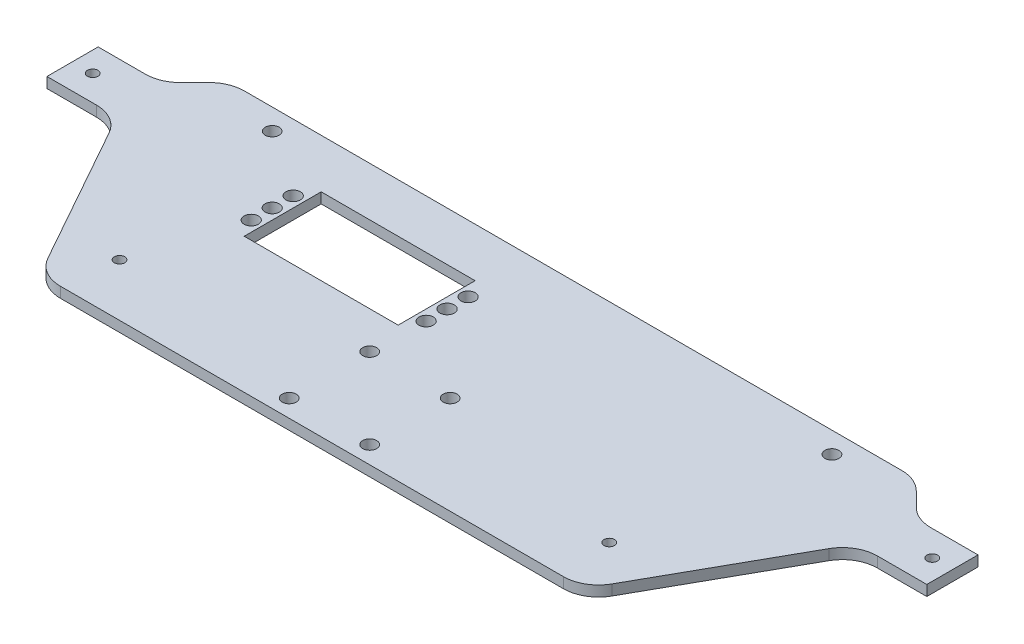
from build123d import *

# Parameters (mm, degrees)
SALIENTE_EXTRUIR1_DEPTH = 3
REDONDEO1_R             = 10
CROQUIS2_R              = 1.5
CROQUIS2_R_2            = 2
CROQUIS2_R_3            = 2.05
CROQUIS2_W              = 42
CROQUIS2_H              = 20
CORTAR_EXTRUIR1_DEPTH   = 135.610141171
CROQUIS3_W              = 4
CROQUIS3_H              = 14.636342218
CORTAR_EXTRUIR2_DEPTH   = 135.610141171
CROQUIS4_W              = 44
CROQUIS4_H              = 22
CORTAR_EXTRUIR3_DEPTH   = 131.820067673
CORTAR_EXTRUIR4_DEPTH   = 131.820067673
REDONDEO2_R             = 20
CORTAR_EXTRUIR5_DEPTH   = 10
REDONDEO3_R             = 10
CROQUIS7_W              = 14.636342218
CROQUIS7_H              = 3
SALIENTE_EXTRUIR2_DEPTH = 2
CROQUIS8_W              = 14.636342218
CROQUIS8_H              = 3
SALIENTE_EXTRUIR3_DEPTH = 2
CROQUIS10_R             = 2
CORTAR_EXTRUIR7_DEPTH   = 133.713564137


with BuildPart() as part:
    # Croquis1 → Saliente-Extruir1 (new body)
    with BuildSketch(Plane(origin=(0, 0, 0), x_dir=(1, 0, 0), z_dir=(0, 1, 0))):
        Polygon((-88.1, 42.318171109), (88.1, 42.318171109), (108.1, 22.318171109), (127.75, 22.318171109), (127.75, 7.681828891), (105.75, 7.681828891), (77.75, -42.318171109), (-77.75, -42.318171109), (-105.75, 7.681828891), (-127.75, 7.681828891), (-127.75, 22.318171109), (-108.1, 22.318171109), align=None)
    extrude(amount=SALIENTE_EXTRUIR1_DEPTH)

    # Redondeo1
    redondeo1_edges = [part.edges().sort_by_distance(p)[0] for p in [
        (-88.1, 1.5, -42.318171109),
        (88.1, 1.5, -42.318171109),
        (108.1, 1.5, -22.318171109),
        (105.75, 1.5, -7.681828891),
        (77.75, 1.5, 42.318171109),
        (-77.75, 1.5, 42.318171109),
        (-105.75, 1.5, -7.681828891),
        (-108.1, 1.5, -22.318171109),
    ]]
    fillet(redondeo1_edges, radius=REDONDEO1_R)

    # Croquis2 → Cortar-Extruir1 (cut, through all)
    with BuildSketch(Plane(origin=(0, 3, 0), x_dir=(1, 0, 0), z_dir=(0, 1, 0))):
        with Locations(Location((70, -27.318171109, 0), (0, 0, 270))):
            Circle(CROQUIS2_R)
        with Locations(Location((-70, -27.318171109, 0), (0, 0, 270))):
            Circle(CROQUIS2_R)
        with Locations(Location((-119.996067812, 15, 0), (0, 0, 270))):
            Circle(CROQUIS2_R)
        with Locations(Location((119.996067812, 15, 0), (0, 0, 270))):
            Circle(CROQUIS2_R)
        with Locations(Location((-11.5, -14.318171109, 0), (0, 0, 270))):
            Circle(CROQUIS2_R_2)
        with Locations(Location((11.5, -14.318171109, 0), (0, 0, 270))):
            Circle(CROQUIS2_R_2)
        with Locations(Location((-11.5, -37.318171109, 0), (0, 0, 270))):
            Circle(CROQUIS2_R_2)
        with Locations(Location((11.5, -37.318171109, 0), (0, 0, 270))):
            Circle(CROQUIS2_R_2)
        with Locations(Location((-61, 7.318171109, 0), (0, 0, 270))):
            Circle(CROQUIS2_R_3)
        with Locations(Location((-11, 7.318171109, 0), (0, 0, 270))):
            Circle(CROQUIS2_R_3)
        with Locations(Location((-61, 13.318171109, 0), (0, 0, 270))):
            Circle(CROQUIS2_R_3)
        with Locations(Location((-61, 1.318171109, 0), (0, 0, 270))):
            Circle(CROQUIS2_R_3)
        with Locations(Location((-11, 13.318171109, 0), (0, 0, 270))):
            Circle(CROQUIS2_R_3)
        with Locations(Location((-11, 1.318171109, 0), (0, 0, 270))):
            Circle(CROQUIS2_R_3)
        with Locations((-36, 7.318171109)):
            Rectangle(CROQUIS2_W, CROQUIS2_H)
    extrude(amount=-CORTAR_EXTRUIR1_DEPTH, mode=Mode.SUBTRACT)

    # Croquis3 → Cortar-Extruir2 (cut, through all)
    with BuildSketch(Plane(origin=(0, 3, 0), x_dir=(1, 0, 0), z_dir=(0, 1, 0))):
        with Locations((-125.75, 15)):
            Rectangle(CROQUIS3_W, CROQUIS3_H)
        with Locations((125.75, 15)):
            Rectangle(CROQUIS3_W, CROQUIS3_H)
    extrude(amount=-CORTAR_EXTRUIR2_DEPTH, mode=Mode.SUBTRACT)

    # Croquis4 → Cortar-Extruir3 (cut, through all)
    with BuildSketch(Plane(origin=(0, 3, 0), x_dir=(1, 0, 0), z_dir=(0, 1, 0))):
        with Locations((-36, 7.318171109)):
            Rectangle(CROQUIS4_W, CROQUIS4_H)
    extrude(amount=-CORTAR_EXTRUIR3_DEPTH, mode=Mode.SUBTRACT)

    # Croquis5 → Cortar-Extruir4 (cut, through all)
    with BuildSketch(Plane(origin=(0, 3, 0), x_dir=(1, 0, 0), z_dir=(0, 1, 0))):
        Polygon((-63.75, 42.318171109), (-38.75, 32.318171109), (38.75, 32.318171109), (63.75, 42.318171109), align=None)
    extrude(amount=-CORTAR_EXTRUIR4_DEPTH, mode=Mode.SUBTRACT)

    # Redondeo2
    redondeo2_edges = [part.edges().sort_by_distance(p)[0] for p in [
        (-63.75, 1.5, -42.318171109),
        (63.75, 1.5, -42.318171109),
        (38.75, 1.5, -32.318171109),
        (-38.75, 1.5, -32.318171109),
    ]]
    fillet(redondeo2_edges, radius=REDONDEO2_R)

    # Croquis6 → Cortar-Extruir5 (cut)
    with BuildSketch(Plane(origin=(0, 3, 0), x_dir=(1, 0, 0), z_dir=(0, 1, 0))):
        Polygon((-34.898351929, 32.318171109), (-98.1, 32.318171109), (-98.1, 50.604425951), (105.42793471, 50.604425951), (105.42793471, 32.318171109), align=None)
    extrude(amount=-CORTAR_EXTRUIR5_DEPTH, mode=Mode.SUBTRACT)

    # Redondeo3
    redondeo3_edges = [part.edges().sort_by_distance(p)[0] for p in [
        (98.1, 1.5, -32.318171109),
        (-98.1, 1.5, -32.318171109),
    ]]
    fillet(redondeo3_edges, radius=REDONDEO3_R)

    # Croquis7 → Saliente-Extruir2 (add)
    with BuildSketch(Plane.ZY.offset(123.75)):
        with Locations((-15, 1.5)):
            Rectangle(CROQUIS7_W, CROQUIS7_H)
    extrude(amount=SALIENTE_EXTRUIR2_DEPTH)

    # Croquis8 → Saliente-Extruir3 (add)
    with BuildSketch(Plane(origin=(123.75, 0, 0), x_dir=(0, 0, -1), z_dir=(1, 0, 0))):
        with Locations((15, 1.5)):
            Rectangle(CROQUIS8_W, CROQUIS8_H)
    extrude(amount=SALIENTE_EXTRUIR3_DEPTH)

    # Croquis10 → Cortar-Extruir7 (cut, through all)
    with BuildSketch(Plane(origin=(0, 3, 0), x_dir=(1, 0, 0), z_dir=(0, 1, 0))):
        with Locations(Location((-80, 26.318171109, 0), (0, 0, 270))):
            Circle(CROQUIS10_R)
        with Locations(Location((80, 26.318171109, 0), (0, 0, 270))):
            Circle(CROQUIS10_R)
    extrude(amount=-CORTAR_EXTRUIR7_DEPTH, mode=Mode.SUBTRACT)


solid = part.part
